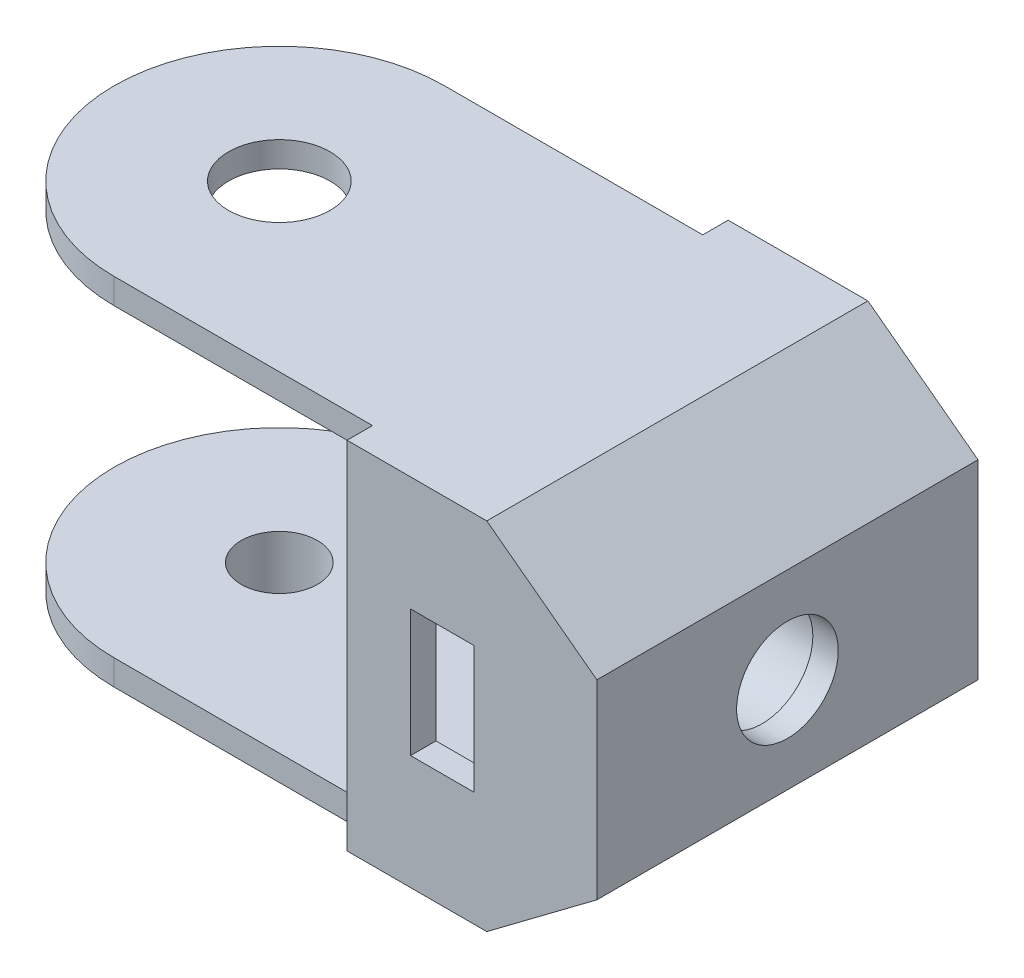
from build123d import *

# Parameters (mm, degrees)
BOSS_EXTRUDE1_DEPTH = 2
SKETCH2_W           = 2
SKETCH2_H           = 26
BOSS_EXTRUDE2_DEPTH = 24
BOSS_EXTRUDE3_DEPTH = 2
SKETCH4_R           = 4
CUT_EXTRUDE1_DEPTH  = 2
BOSS_EXTRUDE4_DEPTH = 26
CUT_EXTRUDE2_DEPTH  = 26
BOSS_EXTRUDE5_DEPTH = 2
SKETCH8_R           = 7.515013345
SKETCH8_R_2         = 4.48835621
BOSS_EXTRUDE6_DEPTH = 4
SKETCH9_R           = 3
CUT_EXTRUDE3_DEPTH  = 10
SKETCH10_R          = 4
CUT_EXTRUDE4_DEPTH  = 10
SKETCH11_R          = 4
SKETCH11_R_2        = 3
BOSS_EXTRUDE7_DEPTH = 7
SKETCH12_R          = 4
BOSS_EXTRUDE8_DEPTH = 1
SKETCH13_W          = 5
SKETCH13_H          = 10
CUT_EXTRUDE5_DEPTH  = 10
SKETCH14_W          = 5
SKETCH14_H          = 10
CUT_EXTRUDE6_DEPTH  = 4


with BuildPart() as part:
    # Sketch1 → Boss-Extrude1 (new body)
    with BuildSketch(Plane(origin=(0, 0, 0), x_dir=(1, 0, 0), z_dir=(0, 1, 0))):
        with BuildLine():
            Line((40, 13), (0, 13))
            ThreePointArc((0, 13), (-13, 0), (0, -13))
            Line((0, -13), (40, -13))
            Line((40, -13), (40, 13))
        make_face()
    extrude(amount=BOSS_EXTRUDE1_DEPTH)

    # Sketch2 → Boss-Extrude2 (add)
    with BuildSketch(Plane(origin=(0, 2, 0), x_dir=(1, 0, 0), z_dir=(0, 1, 0))):
        with Locations((39, 0)):
            Rectangle(SKETCH2_W, SKETCH2_H)
    extrude(amount=BOSS_EXTRUDE2_DEPTH)

    # Sketch3 → Boss-Extrude3 (add)
    with BuildSketch(Plane(origin=(0, 26, 0), x_dir=(1, 0, 0), z_dir=(0, 1, 0))):
        with BuildLine():
            Line((40, -13), (0, -13))
            ThreePointArc((0, -13), (-13, 0), (0, 13))
            Line((0, 13), (40, 13))
            Line((40, 13), (40, -13))
        make_face()
    extrude(amount=BOSS_EXTRUDE3_DEPTH)

    # Sketch4 → Cut-Extrude1 (cut)
    with BuildSketch(Plane(origin=(40, 0, 0), x_dir=(0, 0, -1), z_dir=(1, 0, 0))):
        with Locations((0, 14)):
            Circle(SKETCH4_R)
    extrude(amount=-CUT_EXTRUDE1_DEPTH, mode=Mode.SUBTRACT)

    # Sketch5 → Boss-Extrude4 (add)
    with BuildSketch(Plane.XY.offset(13)):
        Polygon((38, 5), (34, 2), (31.333333333, 0), (31.333333333, 2), (40, 8.5), (40, 6.5), align=None)
        Polygon((40, 21.5), (38, 23), (34, 26), (31.333333333, 28), (31.333333333, 26), (40, 19.5), align=None)
    extrude(amount=-BOSS_EXTRUDE4_DEPTH)

    # Sketch6 → Cut-Extrude2 (cut)
    with BuildSketch(Plane.XY.offset(13)):
        Polygon((38, 5), (31.333333333, 0), (40, 0), (40, 6.5), align=None)
        Polygon((40, 28), (40, 21.5), (38, 23), (31.333333333, 28), align=None)
    extrude(amount=-CUT_EXTRUDE2_DEPTH, mode=Mode.SUBTRACT)

    # Sketch7 → Boss-Extrude5 (add)
    with BuildSketch(Plane.XY.offset(13)):
        Polygon((40, 21.5), (31.333333333, 28), (20.333333333, 28), (20.333333333, 0), (31.333333333, 0), (40, 6.5), align=None)
    boss_extrude5 = extrude(amount=BOSS_EXTRUDE5_DEPTH)

    # Mirror1: Boss-Extrude5 across plane
    add(boss_extrude5.mirror(Plane.XY))

    # Sketch8 → Boss-Extrude6 (add)
    with BuildSketch(Plane.ZY.offset(-38)):
        with Locations(Location((0, 14, 0), (0, 0, 111.335065793))):
            Circle(SKETCH8_R)
        with Locations((0, 14)):
            Circle(SKETCH8_R_2, mode=Mode.SUBTRACT)
    extrude(amount=BOSS_EXTRUDE6_DEPTH)

    # Sketch9 → Cut-Extrude3 (cut)
    with BuildSketch(Plane.XZ):
        with Locations(Location((0, 0, 0), (0, 0, 270))):
            Circle(SKETCH9_R)
    extrude(amount=-CUT_EXTRUDE3_DEPTH, mode=Mode.SUBTRACT)

    # Sketch10 → Cut-Extrude4 (cut)
    with BuildSketch(Plane(origin=(0, 28, 0), x_dir=(1, 0, 0), z_dir=(0, 1, 0))):
        with Locations(Location((0, 0, 0), (0, 0, 270))):
            Circle(SKETCH10_R)
    extrude(amount=-CUT_EXTRUDE4_DEPTH, mode=Mode.SUBTRACT)

    # Sketch11 → Boss-Extrude7 (add)
    with BuildSketch(Plane.XZ):
        with Locations(Location((0, 0, 0), (0, 0, 90))):
            Circle(SKETCH11_R)
        with Locations(Location((0, 0, 0), (0, 0, 270))):
            Circle(SKETCH11_R_2, mode=Mode.SUBTRACT)
    extrude(amount=BOSS_EXTRUDE7_DEPTH)

    # Sketch12 → Boss-Extrude8 (add)
    with BuildSketch(Plane.XZ.offset(7)):
        with Locations(Location((0, 0, 0), (0, 0, 90))):
            Circle(SKETCH12_R)
    extrude(amount=BOSS_EXTRUDE8_DEPTH)

    # Sketch13 → Cut-Extrude5 (cut)
    with BuildSketch(Plane.XY.offset(15)):
        with Locations((27.833333333, 14)):
            Rectangle(SKETCH13_W, SKETCH13_H)
    extrude(amount=-CUT_EXTRUDE5_DEPTH, mode=Mode.SUBTRACT)

    # Sketch14 → Cut-Extrude6 (cut)
    with BuildSketch(Plane(origin=(0, 0, -15), x_dir=(-1, 0, 0), z_dir=(0, 0, -1))):
        with Locations((-27.833333333, 14)):
            Rectangle(SKETCH14_W, SKETCH14_H)
    extrude(amount=-CUT_EXTRUDE6_DEPTH, mode=Mode.SUBTRACT)


solid = part.part
